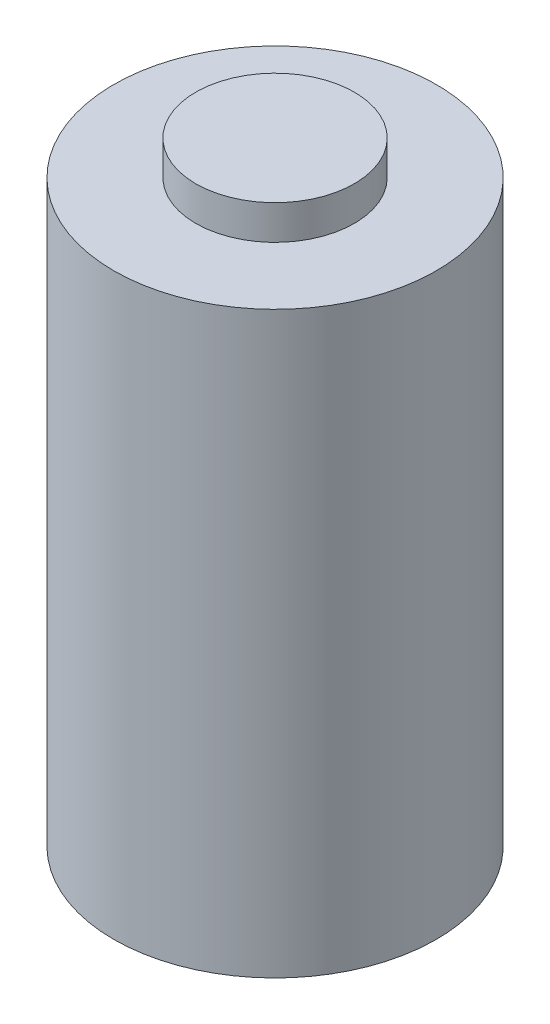
from build123d import *

# Parameters (mm, degrees)
SKETCH_1_R      = 12.2
EXTRUDE_1_DEPTH = 43.8
SKETCH_2_R      = 6
EXTRUDE_2_DEPTH = 2.6


with BuildPart() as part:
    # 草图1 → 凸台-拉伸1 (new body)
    with BuildSketch(Plane(origin=(0, 0, 0), x_dir=(1, 0, 0), z_dir=(0, 1, 0))):
        with Locations(Location((0, 0, 0), (0, 0, 270))):
            Circle(SKETCH_1_R)
    extrude(amount=EXTRUDE_1_DEPTH)

    # 草图2 → 凸台-拉伸2 (add)
    with BuildSketch(Plane(origin=(0, 43.8, 0), x_dir=(1, 0, 0), z_dir=(0, 1, 0))):
        with Locations(Location((0, 0, 0), (0, 0, 270))):
            Circle(SKETCH_2_R)
    extrude(amount=EXTRUDE_2_DEPTH)


solid = part.part
